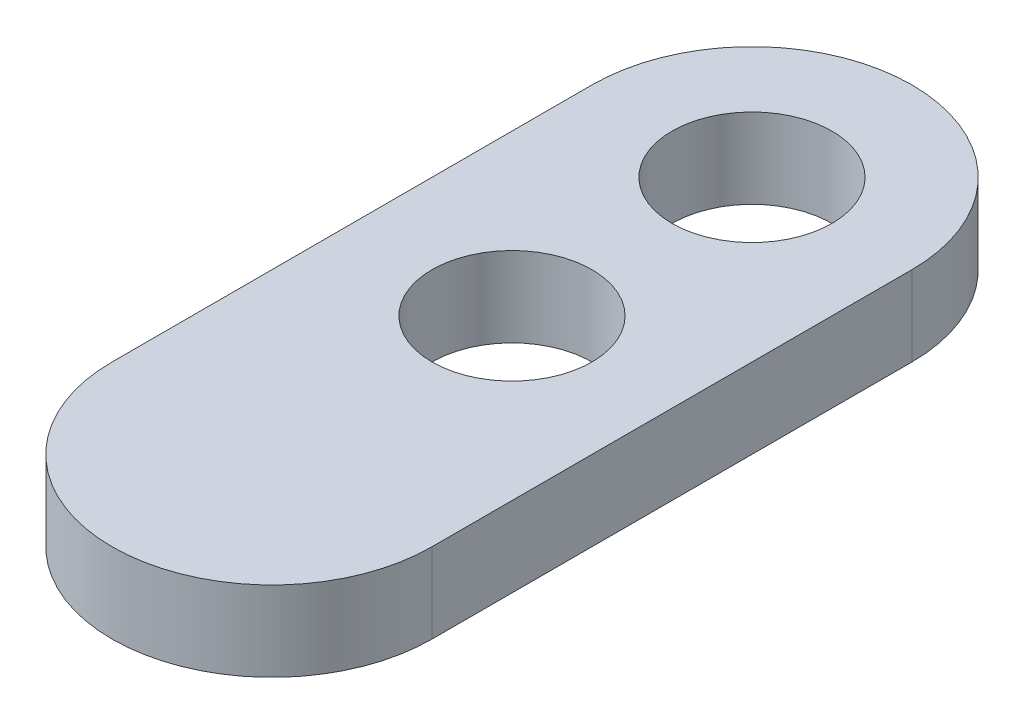
from build123d import *

# Parameters (mm, degrees)
SKETCH1_W           = 10
SKETCH1_H           = 15
BOSS_EXTRUDE1_DEPTH = 2.5
CUT_EXTRUDE1_REACH  = 15.693
SKETCH2_R           = 2.5


with BuildPart() as part:
    # Sketch1 → Boss-Extrude1 (new body)
    with BuildSketch(Plane(origin=(0, 0, 0), x_dir=(1, 0, 0), z_dir=(0, 1, 0))):
        with BuildLine():
            ThreePointArc((-5, 7.5), (0, 12.5), (5, 7.5))
            Line((5, 7.5), (-5, 7.5))
        make_face()
        Rectangle(SKETCH1_W, SKETCH1_H)
        with BuildLine():
            Line((-5, -7.5), (5, -7.5))
            ThreePointArc((5, -7.5), (0, -12.5), (-5, -7.5))
        make_face()
    extrude(amount=BOSS_EXTRUDE1_DEPTH)

    # Sketch2 → Cut-Extrude1 (cut, up to next)
    with BuildSketch(Plane(origin=(0, 2.5, 0), x_dir=(1, 0, 0), z_dir=(0, 1, 0)), mode=Mode.PRIVATE) as cut_extrude1_sk1:
        with Locations(Location((0, 7.5, 0), (0, 0, 270))):
            Circle(SKETCH2_R)
    cut_extrude1_tool1 = extrude(cut_extrude1_sk1.sketch, amount=-CUT_EXTRUDE1_REACH, mode=Mode.PRIVATE) & part.part
    # Sketch2 → Cut-Extrude1 (cut, up to next)
    with BuildSketch(Plane(origin=(0, 2.5, 0), x_dir=(1, 0, 0), z_dir=(0, 1, 0)), mode=Mode.PRIVATE) as cut_extrude1_sk2:
        with Locations(Location((0, 0, 0), (0, 0, 270))):
            Circle(SKETCH2_R)
    cut_extrude1_tool2 = extrude(cut_extrude1_sk2.sketch, amount=-CUT_EXTRUDE1_REACH, mode=Mode.PRIVATE) & part.part
    add(cut_extrude1_tool1.solids().sort_by_distance((0, 2.5, -7.5))[0], mode=Mode.SUBTRACT)
    add(cut_extrude1_tool2.solids().sort_by_distance((0, 2.5, 0))[0], mode=Mode.SUBTRACT)


solid = part.part
